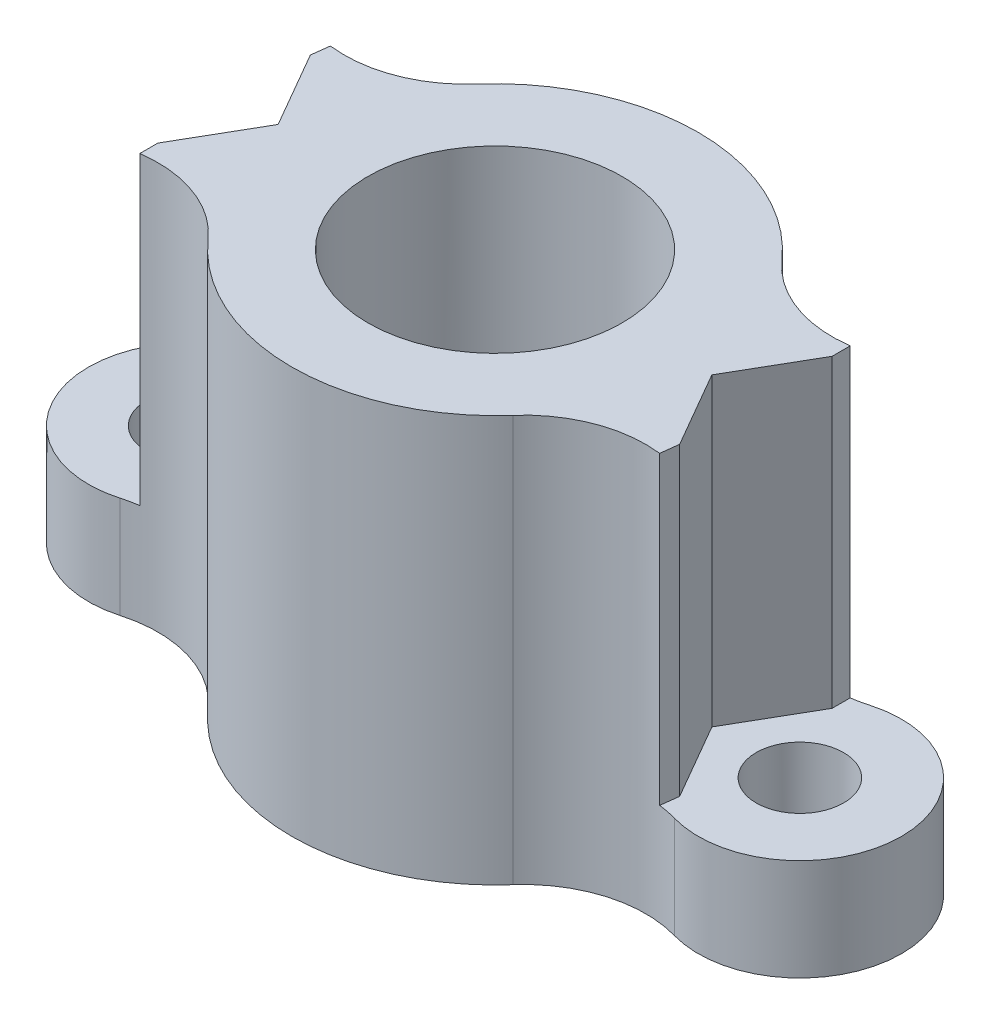
from build123d import *

# Parameters (mm, degrees)
BOSS_EXTRUDE1_DEPTH = 20
SKETCH2_R           = 6.25
CUT_EXTRUDE1_DEPTH  = 11
SKETCH2_3_R         = 2.15
CUT_EXTRUDE2_DEPTH  = 31
CUT_EXTRUDE3_START  = -15
SKETCH2_4_R         = 2.15
CUT_EXTRUDE3_DEPTH  = 15
SKETCH3_R           = 2.25
CUT_EXTRUDE4_DEPTH  = 25.919871589
SKETCH4_R           = 4
CUT_EXTRUDE5_DEPTH  = 4


with BuildPart() as part:
    # Sketch1 → Boss-Extrude1 (new body)
    with BuildSketch(Plane(origin=(0, 0, 0), x_dir=(1, 0, 0), z_dir=(0, 1, 0))):
        with BuildLine():
            ThreePointArc((-7.5, -6.614378278), (0, -10), (7.5, -6.614378278))
            ThreePointArc((7.5, -6.614378278), (10.307771776, -4.826585903), (13.636363636, -4.810456929))
            ThreePointArc((13.636363636, -4.810456929), (20, 0), (13.636363636, 4.810456929))
            ThreePointArc((13.636363636, 4.810456929), (10.307771776, 4.826585903), (7.5, 6.614378278))
            ThreePointArc((7.5, 6.614378278), (0, 10), (-7.5, 6.614378278))
            ThreePointArc((-7.5, 6.614378278), (-10.307771776, 4.826585903), (-13.636363636, 4.810456929))
            ThreePointArc((-13.636363636, 4.810456929), (-20, 0), (-13.636363636, -4.810456929))
            ThreePointArc((-13.636363636, -4.810456929), (-10.307771776, -4.826585903), (-7.5, -6.614378278))
        make_face()
    extrude(amount=BOSS_EXTRUDE1_DEPTH)

    # Sketch2 → Cut-Extrude1 (cut)
    with BuildSketch(Plane(origin=(0, 20, 0), x_dir=(1, 0, 0), z_dir=(0, 1, 0))):
        with Locations(Location((0, 0, 0), (0, 0, 270))):
            Circle(SKETCH2_R)
    extrude(amount=-CUT_EXTRUDE1_DEPTH, mode=Mode.SUBTRACT)

    # Sketch2<3> → Cut-Extrude2 (cut, through all)
    with BuildSketch(Plane(origin=(0, 20, 0), x_dir=(1, 0, 0), z_dir=(0, 1, 0))):
        with Locations(Location((-15, 0, 0), (0, 0, 270))):
            Circle(SKETCH2_3_R)
        with Locations(Location((15, 0, 0), (0, 0, 270))):
            Circle(SKETCH2_3_R)
    extrude(amount=-CUT_EXTRUDE2_DEPTH, mode=Mode.SUBTRACT)

    # Sketch2<4> → Cut-Extrude3 (cut)
    # profile 1 of 2: a face of its own
    with BuildSketch(Plane(origin=(0, 20, 0), x_dir=(1, 0, 0), z_dir=(0, 1, 0)).offset(CUT_EXTRUDE3_START)):
        with BuildLine():
            Line((-10.669872981, 0), (-12.834936491, 3.75))
            Line((-12.834936491, 3.75), (-12.727737442, 4.627302245))
            ThreePointArc((-12.727737442, 4.627302245), (-13.185592631, 4.701307351), (-13.636363636, 4.810456929))
            ThreePointArc((-13.636363636, 4.810456929), (-20, 0), (-13.636363636, -4.810456929))
            ThreePointArc((-13.636363636, -4.810456929), (-13.238538502, -4.712228262), (-12.834936491, -4.641382481))
            Line((-12.834936491, -4.641382481), (-12.834936491, -3.75))
            Line((-12.834936491, -3.75), (-10.669872981, 0))
        make_face()
        with Locations(Location((-15, 0, 0), (0, 0, 270))):
            Circle(SKETCH2_4_R, mode=Mode.SUBTRACT)
    # profile 2 of 2: a face of its own
    with BuildSketch(Plane(origin=(0, 20, 0), x_dir=(1, 0, 0), z_dir=(0, 1, 0)).offset(CUT_EXTRUDE3_START)):
        with BuildLine():
            ThreePointArc((13.636363636, 4.810456929), (13.238538502, 4.712228262), (12.834936491, 4.641382481))
            Line((12.834936491, 4.641382481), (12.834936491, 3.75))
            Line((12.834936491, 3.75), (10.669872981, 0))
            Line((10.669872981, 0), (12.834936491, -3.75))
            Line((12.834936491, -3.75), (12.727737442, -4.627302245))
            ThreePointArc((12.727737442, -4.627302245), (13.185592631, -4.701307351), (13.636363636, -4.810456929))
            ThreePointArc((13.636363636, -4.810456929), (20, 0), (13.636363636, 4.810456929))
        make_face()
        with Locations(Location((15, 0, 0), (0, 0, 270))):
            Circle(SKETCH2_4_R, mode=Mode.SUBTRACT)
    extrude(amount=CUT_EXTRUDE3_DEPTH, mode=Mode.SUBTRACT)

    # Sketch3 → Cut-Extrude4 (cut, through all)
    with BuildSketch(Plane(origin=(0, 9, 0), x_dir=(1, 0, 0), z_dir=(0, 1, 0))):
        with Locations(Location((0, 0, 0), (0, 0, 270))):
            Circle(SKETCH3_R)
    extrude(amount=-CUT_EXTRUDE4_DEPTH, mode=Mode.SUBTRACT)

    # Sketch4 → Cut-Extrude5 (cut)
    with BuildSketch(Plane.XZ):
        with Locations(Location((0, 0, 0), (0, 0, 270))):
            Circle(SKETCH4_R)
    extrude(amount=-CUT_EXTRUDE5_DEPTH, mode=Mode.SUBTRACT)


solid = part.part
